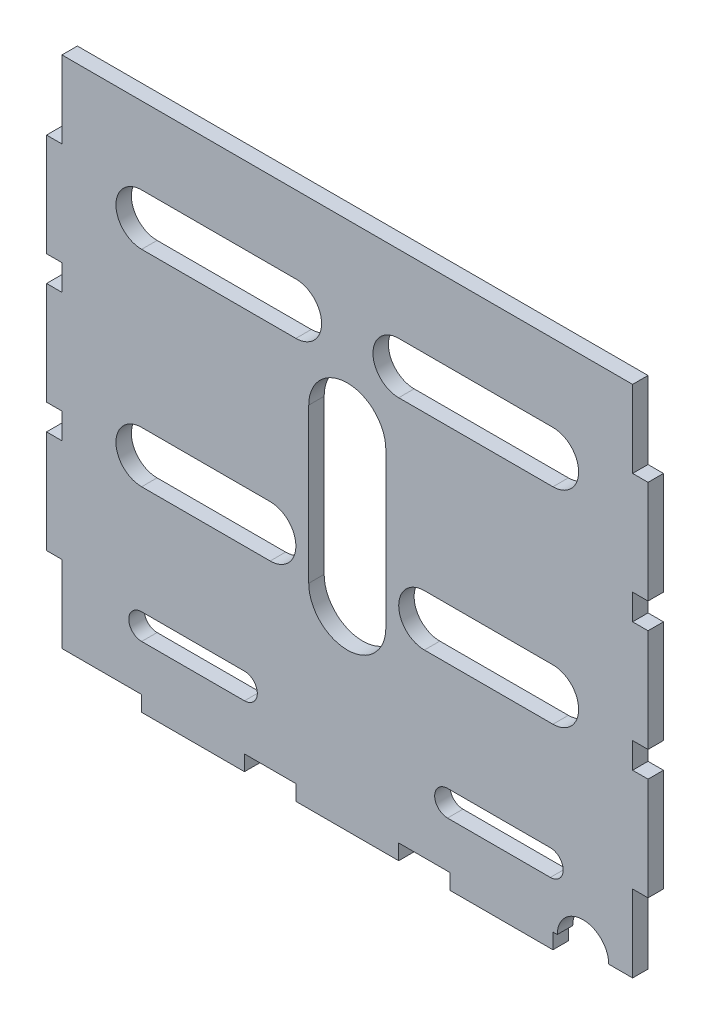
from build123d import *

# Parameters (mm, degrees)
BOSS_EXTRUDE1_DEPTH = 3


with BuildPart() as part:
    # Sketch1 → Boss-Extrude1 (new body)
    with BuildSketch(Plane.XY):
        with BuildLine():
            Line((-55.5, -50), (-40, -50))
            Line((-40, -50), (-40, -53))
            Line((-40, -53), (-20, -53))
            Line((-20, -53), (-20, -50))
            Line((-20, -50), (-10, -50))
            Line((-10, -50), (-10, -53))
            Line((-10, -53), (10, -53))
            Line((10, -53), (10, -50))
            Line((10, -50), (20, -50))
            Line((20, -50), (20, -53))
            Line((20, -53), (40, -53))
            Line((40, -53), (40, -50))
            Line((40, -50), (40.851130485, -50))
            ThreePointArc((40.851130485, -50), (45.851130485, -45), (50.851130485, -50))
            Line((50.851130485, -50), (55.5, -50))
            Line((55.5, -50), (55.5, -35))
            Line((55.5, -35), (58.5, -35))
            Line((58.5, -35), (58.5, -15))
            Line((58.5, -15), (55.5, -15))
            Line((55.5, -15), (55.5, -10))
            Line((55.5, -10), (58.5, -10))
            Line((58.5, -10), (58.5, 10))
            Line((58.5, 10), (55.5, 10))
            Line((55.5, 10), (55.5, 15))
            Line((55.5, 15), (58.5, 15))
            Line((58.5, 15), (58.5, 35))
            Line((58.5, 35), (55.5, 35))
            Line((55.5, 35), (55.5, 50))
            Line((55.5, 50), (-55.5, 50))
            Line((-55.5, 50), (-55.5, 35))
            Line((-55.5, 35), (-58.5, 35))
            Line((-58.5, 35), (-58.5, 15))
            Line((-58.5, 15), (-55.5, 15))
            Line((-55.5, 15), (-55.5, 10))
            Line((-55.5, 10), (-58.5, 10))
            Line((-58.5, 10), (-58.5, -10))
            Line((-58.5, -10), (-55.5, -10))
            Line((-55.5, -10), (-55.5, -15))
            Line((-55.5, -15), (-58.5, -15))
            Line((-58.5, -15), (-58.5, -35))
            Line((-58.5, -35), (-55.5, -35))
            Line((-55.5, -35), (-55.5, -50))
        make_face()
        with BuildLine():
            Line((-40, 35), (-10, 35))
            ThreePointArc((-10, 35), (-5, 30), (-10, 25))
            Line((-10, 25), (-40, 25))
            ThreePointArc((-40, 25), (-45, 30), (-40, 35))
        make_face(mode=Mode.SUBTRACT)
        with BuildLine():
            Line((10, 35), (40, 35))
            ThreePointArc((40, 35), (45, 30), (40, 25))
            Line((40, 25), (10, 25))
            ThreePointArc((10, 25), (5, 30), (10, 35))
        make_face(mode=Mode.SUBTRACT)
        with BuildLine():
            Line((-7.5, -15), (-7.5, 15))
            ThreePointArc((-7.5, 15), (0, 22.5), (7.5, 15))
            Line((7.5, 15), (7.5, -15))
            ThreePointArc((7.5, -15), (0, -22.5), (-7.5, -15))
        make_face(mode=Mode.SUBTRACT)
        with BuildLine():
            Line((-40, -5), (-15, -5))
            ThreePointArc((-15, -5), (-10, -10), (-15, -15))
            Line((-15, -15), (-40, -15))
            ThreePointArc((-40, -15), (-45, -10), (-40, -5))
        make_face(mode=Mode.SUBTRACT)
        with BuildLine():
            Line((15, -5), (40, -5))
            ThreePointArc((40, -5), (45, -10), (40, -15))
            Line((40, -15), (15, -15))
            ThreePointArc((15, -15), (10, -10), (15, -5))
        make_face(mode=Mode.SUBTRACT)
        with BuildLine():
            Line((-40, -36.056835362), (-20, -36.056835362))
            ThreePointArc((-20, -36.056835362), (-17.5, -38.556835362), (-20, -41.056835362))
            Line((-20, -41.056835362), (-40, -41.056835362))
            ThreePointArc((-40, -41.056835362), (-42.5, -38.556835362), (-40, -36.056835362))
        make_face(mode=Mode.SUBTRACT)
        with BuildLine():
            Line((39.496814851, -41.056835362), (19.496814851, -41.056835362))
            ThreePointArc((19.496814851, -41.056835362), (16.996814851, -38.556835362), (19.496814851, -36.056835362))
            Line((19.496814851, -36.056835362), (39.496814851, -36.056835362))
            ThreePointArc((39.496814851, -36.056835362), (41.996814851, -38.556835362), (39.496814851, -41.056835362))
        make_face(mode=Mode.SUBTRACT)
    extrude(amount=BOSS_EXTRUDE1_DEPTH)


solid = part.part
